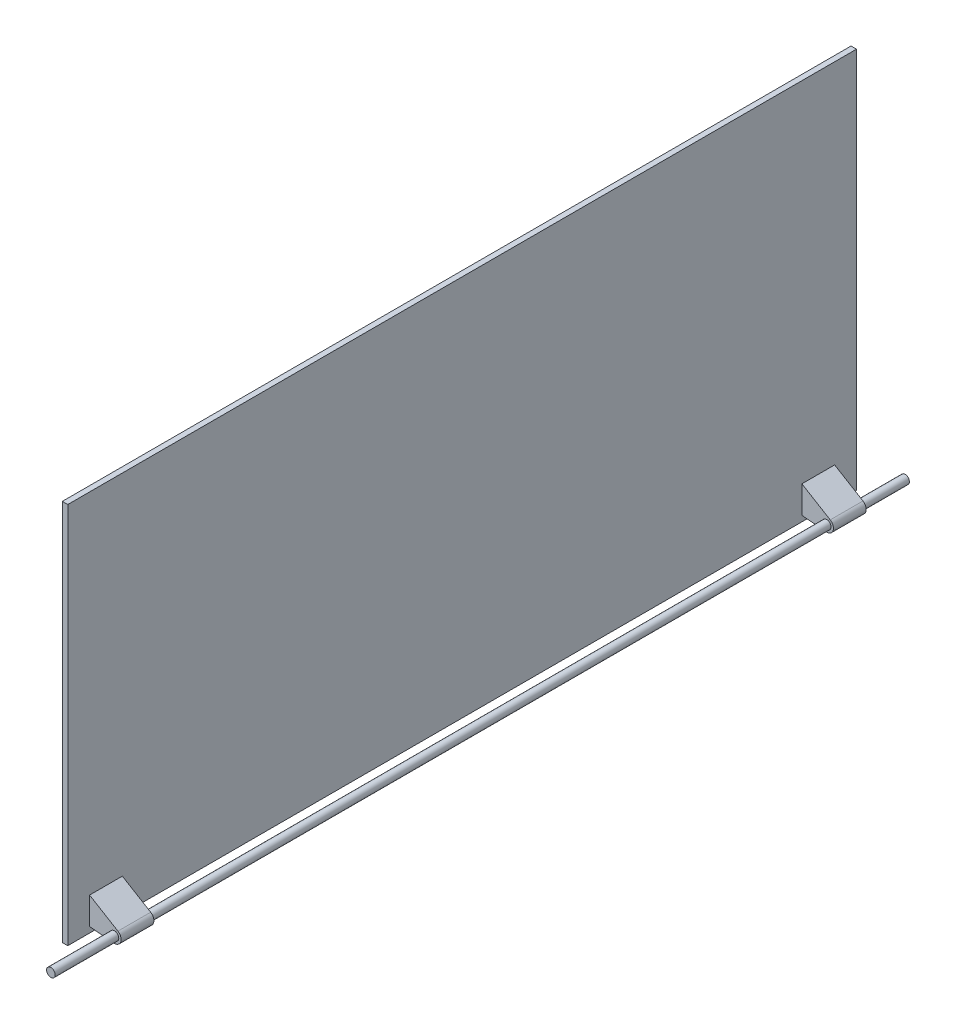
from build123d import *

# Parameters (mm, degrees)
SKETCH1_W                = 734.06
SKETCH1_H                = 355.6
BOSS_EXTRUDE1_DEPTH      = 5.08
SKETCH6_R                = 4.0005
BOSS_EXTRUDE2_DEPTH      = 30.48
BOSS_EXTRUDE3_DEPTH      = 59.182
BOSS_EXTRUDE3_DEPTH_BACK = 735.838
SKETCH7_R                = 4.0005


with BuildPart() as part:
    # Sketch1 → Boss-Extrude1 (new body)
    with BuildSketch(Plane(origin=(0, 0, 0), x_dir=(0, 0, -1), z_dir=(1, 0, 0))):
        Rectangle(SKETCH1_W, SKETCH1_H)
    extrude(amount=BOSS_EXTRUDE1_DEPTH)


with BuildPart() as body_2:
    # Sketch6 → Boss-Extrude2 (new body)
    with BuildSketch(Plane.XY.offset(316.23)):
        with BuildLine():
            Line((5.08, -147.133142153), (5.08, -172.533142153))
            Line((5.08, -172.533142153), (27.691604266, -174.522209914))
            ThreePointArc((27.691604266, -174.522209914), (34.133973448, -170.265087909), (31.439236588, -163.028679843))
            Line((31.439236588, -163.028679843), (5.08, -147.133142153))
        make_face()
        with Locations(Location((28.23528027, -168.341733372, 0), (0, 0, 180))):
            Circle(SKETCH6_R, mode=Mode.SUBTRACT)
    extrude(amount=BOSS_EXTRUDE2_DEPTH)


with BuildPart() as body_3:
    # Mirror5: mirrored copy
    add(body_2.part.mirror(Plane.XY))


with BuildPart() as body_2_1:
    add(body_2.part)

    add(body_3.part)  # Boss-Extrude3 merges body 3
    # Sketch7 → Boss-Extrude3 (add, two sides: drawn at the far end of the back side and taken through both)
    with BuildSketch(Plane.XY.offset(346.71).offset(-BOSS_EXTRUDE3_DEPTH_BACK)):
        with Locations((28.23528027, -168.341733372)):
            Circle(SKETCH7_R)
    extrude(amount=BOSS_EXTRUDE3_DEPTH + BOSS_EXTRUDE3_DEPTH_BACK)


solid = Compound([part.part, body_2_1.part])
